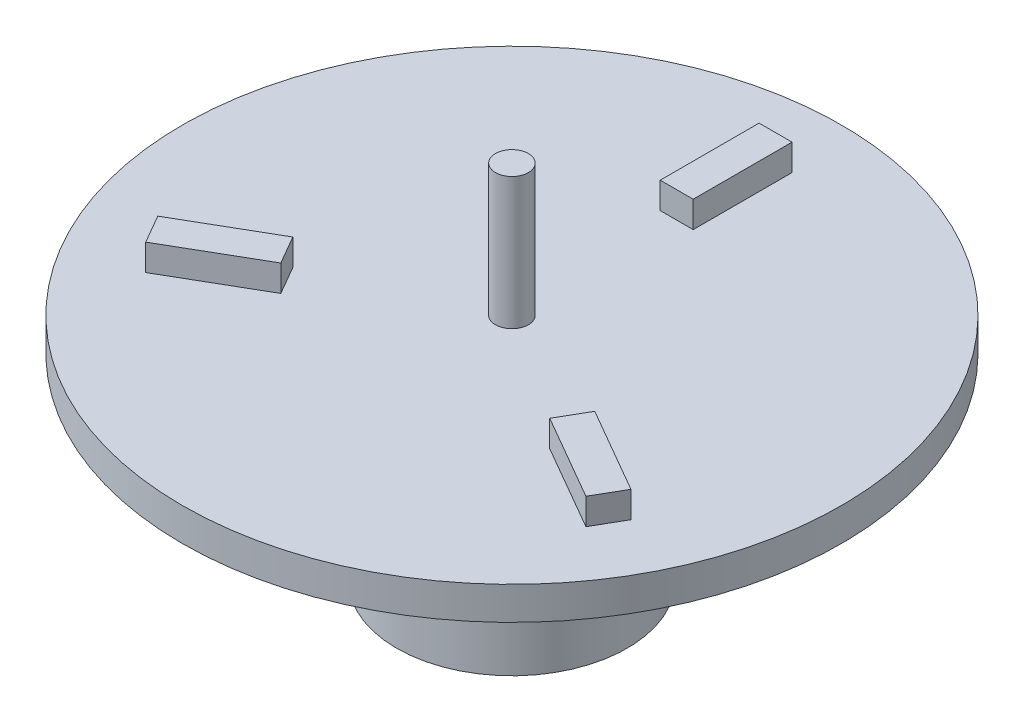
from build123d import *

# Parameters (mm, degrees)
ESQUISSE1_R                  = 3.5
BOSS_EXTRU_1_DEPTH           = 5
ESQUISSE4_R                  = 5.5
BOSS_EXTRU_3_DEPTH           = 1
ESQUISSE5_R                  = 10
BOSS_EXTRU_4_DEPTH           = 1
ESQUISSE6_R                  = 0.5
BOSS_EXTRU_5_DEPTH           = 4
BOSS_EXTRU_6_DEPTH           = 0.8
R_P_TITION_CIRCULAIRE1_COUNT = 3


with BuildPart() as part:
    # Esquisse1 → Boss.-Extru.1 (new body)
    with BuildSketch(Plane(origin=(0, 0, 0), x_dir=(1, 0, 0), z_dir=(0, 1, 0))):
        with Locations(Location((0, 0, 0), (0, 0, 270))):
            Circle(ESQUISSE1_R)
    extrude(amount=BOSS_EXTRU_1_DEPTH)

    # Esquisse4 → Boss.-Extru.3 (add)
    with BuildSketch(Plane(origin=(0, 5, 0), x_dir=(1, 0, 0), z_dir=(0, 1, 0))):
        with Locations(Location((0, 0, 0), (0, 0, 270))):
            Circle(ESQUISSE4_R)
    extrude(amount=BOSS_EXTRU_3_DEPTH)

    # Esquisse5 → Boss.-Extru.4 (add)
    with BuildSketch(Plane(origin=(0, 6, 0), x_dir=(1, 0, 0), z_dir=(0, 1, 0))):
        with Locations(Location((0, 0, 0), (0, 0, 270))):
            Circle(ESQUISSE5_R)
    extrude(amount=BOSS_EXTRU_4_DEPTH)

    # Esquisse6 → Boss.-Extru.5 (add)
    with BuildSketch(Plane(origin=(0, 7, 0), x_dir=(1, 0, 0), z_dir=(0, 1, 0))):
        with Locations(Location((0, 0, 0), (0, 0, 270))):
            Circle(ESQUISSE6_R)
    extrude(amount=BOSS_EXTRU_5_DEPTH)

    # Esquisse7 → Boss.-Extru.6 (add)
    with BuildSketch(Plane(origin=(0, 7, 0), x_dir=(1, 0, 0), z_dir=(0, 1, 0))):
        Polygon((0, 5), (0.5, 5), (0.5, 8), (-0.5, 8), (-0.5, 5), align=None)
    boss_extru_6 = extrude(amount=BOSS_EXTRU_6_DEPTH)

    # Répétition circulaire1: Boss.-Extru.6 ×3 about axis
    r_p_tition_circulaire1_axis = Axis((0, 0, 0), (0, 1, 0))
    for i in range(1, R_P_TITION_CIRCULAIRE1_COUNT):
        add(boss_extru_6.rotate(r_p_tition_circulaire1_axis, i * 360 / R_P_TITION_CIRCULAIRE1_COUNT))


solid = part.part
